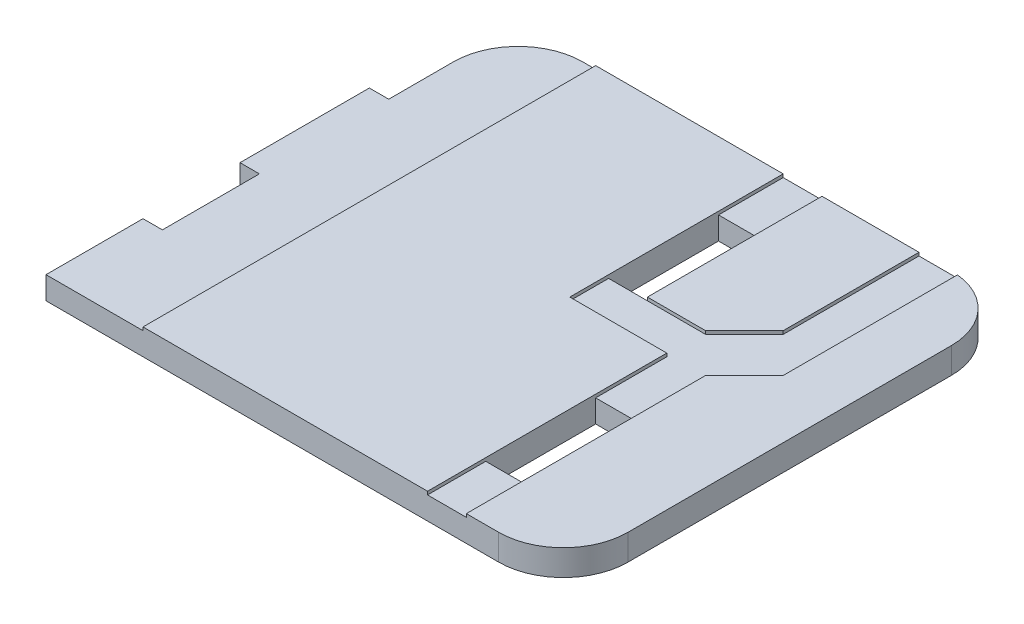
from build123d import *

# Parameters (mm, degrees)
SKETCH1_W           = 0.6
SKETCH1_H           = 1.7
BOSS_EXTRUDE1_DEPTH = 0.4
FILLET1_R           = 1
SKETCH3_W           = 0.6
SKETCH3_H           = 0.9
SKETCH3_H_2         = 1
CUT_EXTRUDE2_DEPTH  = 0.05


with BuildPart() as part:
    # Sketch1 → Boss-Extrude1 (new body)
    with BuildSketch(Plane(origin=(0, 0, 0), x_dir=(1, 0, 0), z_dir=(0, 1, 0))):
        Polygon((0, 0), (8, 0), (8, 7), (0.3, 7), (0.3, 5), (0, 5), (0, 3), (0.3, 3), (0.3, 1.5), (0, 1.5), align=None)
        with Locations((4.7, 5.15)):
            Rectangle(SKETCH1_W, SKETCH1_H, mode=Mode.SUBTRACT)
        with Locations((6.2, 1.75)):
            Rectangle(SKETCH1_W, SKETCH1_H, mode=Mode.SUBTRACT)
    extrude(amount=BOSS_EXTRUDE1_DEPTH)

    # Fillet1
    fillet1_edges = [part.edges().sort_by_distance(p)[0] for p in [
        (0.3, 0.2, -7),
        (8, 0.2, -7),
        (8, 0.2, 0),
    ]]
    fillet(fillet1_edges, radius=FILLET1_R)

    # Sketch3 → Cut-Extrude2 (cut)
    with BuildSketch(Plane(origin=(0, 0.4, 0), x_dir=(1, 0, 0), z_dir=(0, 1, 0))):
        with BuildLine():
            Line((1.5, 0), (1.5, 7))
            Line((1.5, 7), (1.3, 7))
            ThreePointArc((1.3, 7), (0.592893219, 6.707106781), (0.3, 6))
            Line((0.3, 6), (0.3, 5))
            Line((0.3, 5), (0, 5))
            Line((0, 5), (0, 3))
            Line((0, 3), (0.3, 3))
            Line((0.3, 3), (0.3, 1.5))
            Line((0.3, 1.5), (0, 1.5))
            Line((0, 1.5), (0, 0))
            Line((0, 0), (1.5, 0))
        make_face()
        with Locations((6.2, 0.45)):
            Rectangle(SKETCH3_W, SKETCH3_H)
        Polygon((4.4, 4.3), (5, 4.3), (5.9, 4.3), (6.5, 4.9), (6.5, 7), (6.5, 7.268876882), (7.1, 7.268876882), (7.1, 6.994987437), (7.1, 4.3), (6.5, 3.7), (6.5, 2.6), (5.9, 2.6), (5.9, 3.7), (4.4, 3.7), align=None)
        with Locations((4.7, 6.5)):
            Rectangle(SKETCH3_W, SKETCH3_H_2)
    extrude(amount=-CUT_EXTRUDE2_DEPTH, mode=Mode.SUBTRACT)


solid = part.part
